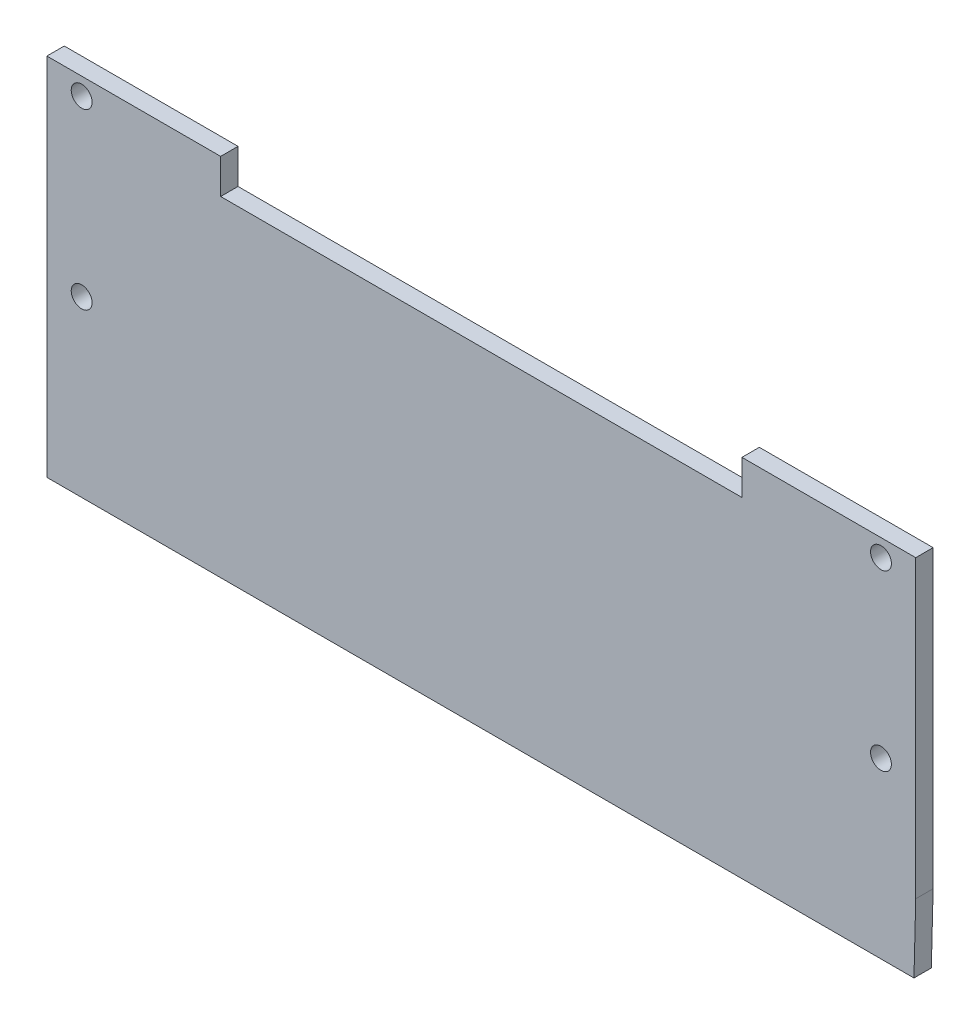
from build123d import *

# Parameters (mm, degrees)
ESQUISSE1_W             = 250
ESQUISSE1_H             = 85
ESQUISSE1_R             = 3
BOSS_EXTRU_1_DEPTH      = 5
BOSS_EXTRU_2_DEPTH      = 5
ESQUISSE3_W             = 150
ESQUISSE3_H             = 10
ENL_V_MAT_EXTRU_1_DEPTH = 10


with BuildPart() as part:
    # Esquisse1 → Boss.-Extru.1 (new body)
    with BuildSketch(Plane.XY):
        with Locations((125, -42.5)):
            Rectangle(ESQUISSE1_W, ESQUISSE1_H)
        with Locations((10, -5)):
            Circle(ESQUISSE1_R, mode=Mode.SUBTRACT)
        with Locations((10, -55)):
            Circle(ESQUISSE1_R, mode=Mode.SUBTRACT)
        with Locations(Location((240, -55, 0), (0, 0, 180))):
            Circle(ESQUISSE1_R, mode=Mode.SUBTRACT)
        with Locations(Location((240, -5, 0), (0, 0, 180))):
            Circle(ESQUISSE1_R, mode=Mode.SUBTRACT)
    extrude(amount=BOSS_EXTRU_1_DEPTH)

    # Esquisse2 → Boss.-Extru.2 (add)
    with BuildSketch(Plane.XY.offset(5)):
        Polygon((0, -85), (0, -105), (249.491359447, -105), (250, -85), align=None)
    extrude(amount=-BOSS_EXTRU_2_DEPTH)

    # Esquisse3 → Enlèv. mat.-Extru.1 (cut)
    with BuildSketch(Plane(origin=(0, 0, 0), x_dir=(-1, 0, 0), z_dir=(0, 0, -1))):
        with Locations((-125, -5)):
            Rectangle(ESQUISSE3_W, ESQUISSE3_H)
    extrude(amount=-ENL_V_MAT_EXTRU_1_DEPTH, mode=Mode.SUBTRACT)


solid = part.part
